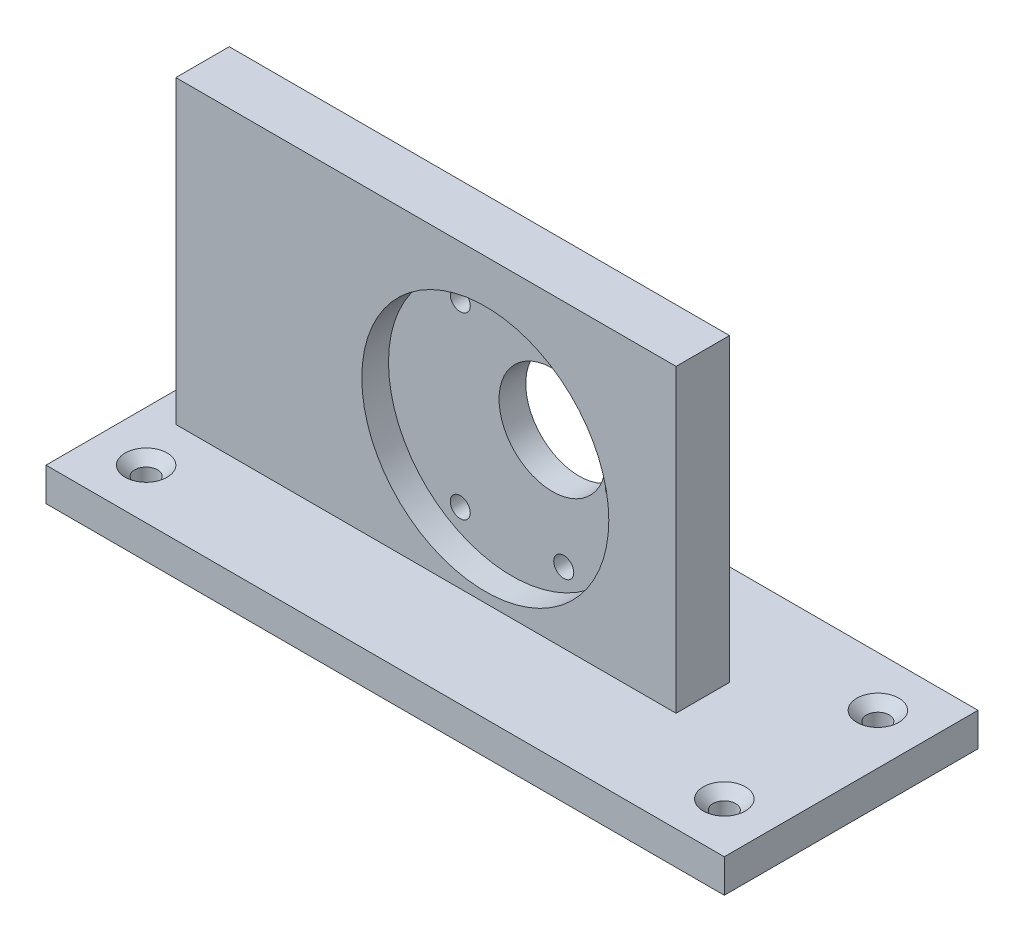
from build123d import *

# Parameters (mm, degrees)
SKETCH3_W                                       = 57.15
SKETCH3_H                                       = 50
BOSS_EXTRUDE1_DEPTH                             = 8
SKETCH3_3_R                                     = 1.5
SKETCH3_3_R_2                                   = 8
CUT_EXTRUDE2_DEPTH                              = 10
SKETCH4_R                                       = 18.5
CUT_EXTRUDE3_DEPTH                              = 4
BOSS_EXTRUDE2_DEPTH                             = 15
BOSS_EXTRUDE2_DEPTH_BACK                        = 23
SKETCH6_W                                       = 101.6
SKETCH6_H                                       = 5
CSK_FOR_M3_FLAT_HEAD_MACHINE_SCREW1_D           = 3.4
CSK_FOR_M3_FLAT_HEAD_MACHINE_SCREW1_CSINK_D     = 6.3
CSK_FOR_M3_FLAT_HEAD_MACHINE_SCREW1_CSINK_ANGLE = 90
CUT_EXTRUDE6_REACH                              = 555.432
SKETCH16_R                                      = 1.7
CUT_EXTRUDE7_REACH                              = 73.656
SKETCH17_W                                      = 25.08228791
SKETCH17_H                                      = 11.980848154
SKETCH18_W                                      = 17.78
SKETCH18_H                                      = 8
BOSS_EXTRUDE3_DEPTH                             = 45
SKETCH13_R                                      = 6.7056
SKETCH13_R_2                                    = 4.8006
BOSS_EXTRUDE4_DEPTH                             = 5.08
CUT_EXTRUDE8_START                              = -5.08
SKETCH19_R                                      = 4.8006
CUT_EXTRUDE8_DEPTH                              = 5.08


with BuildPart() as part:
    # Sketch3 → Boss-Extrude1 (new body)
    with BuildSketch(Plane.XY):
        with Locations((0, 25)):
            Rectangle(SKETCH3_W, SKETCH3_H)
    extrude(amount=BOSS_EXTRUDE1_DEPTH)

    # Sketch3<3> → Cut-Extrude2 (cut)
    with BuildSketch(Plane.XY):
        with Locations(Location((-7.75, 38.423393759, 0), (0, 0, 180))):
            Circle(SKETCH3_3_R)
        with Locations(Location((7.75, 38.423393759, 0), (0, 0, 180))):
            Circle(SKETCH3_3_R)
        with Locations(Location((-7.75, 11.576606241, 0), (0, 0, 180))):
            Circle(SKETCH3_3_R)
        with Locations(Location((7.75, 11.576606241, 0), (0, 0, 180))):
            Circle(SKETCH3_3_R)
        with Locations(Location((15.5, 25, 0), (0, 0, 180))):
            Circle(SKETCH3_3_R)
        with Locations(Location((6.062177825, 28.499999999, 0), (0, 0, 180))):
            Circle(SKETCH3_3_R_2)
    extrude(amount=CUT_EXTRUDE2_DEPTH, mode=Mode.SUBTRACT)

    # Sketch4 → Cut-Extrude3 (cut)
    with BuildSketch(Plane.XY.offset(8)):
        with Locations((0, 25)):
            Circle(SKETCH4_R)
    extrude(amount=-CUT_EXTRUDE3_DEPTH, mode=Mode.SUBTRACT)

    # Sketch6 → Boss-Extrude2 (add, two sides: drawn at the far end of the back side and taken through both)
    with BuildSketch(Plane.XY.offset(8).offset(-BOSS_EXTRUDE2_DEPTH_BACK)):
        with Locations((0, 2.5)):
            Rectangle(SKETCH6_W, SKETCH6_H)
    extrude(amount=BOSS_EXTRUDE2_DEPTH + BOSS_EXTRUDE2_DEPTH_BACK)

    # CSK for M3 Flat Head Machine Screw1 (through all)
    with Locations(Plane(origin=(0, 5, 0), x_dir=(1, 0, 0), z_dir=(0, 1, 0))):
        with Locations((-43.3, 7.5), (-43.3, -15.5), (43.3, -15.5), (43.3, 7.5)):
            CounterSinkHole(CSK_FOR_M3_FLAT_HEAD_MACHINE_SCREW1_D / 2, CSK_FOR_M3_FLAT_HEAD_MACHINE_SCREW1_CSINK_D / 2, counter_sink_angle=CSK_FOR_M3_FLAT_HEAD_MACHINE_SCREW1_CSINK_ANGLE)

    # Sketch16 → Cut-Extrude6 (cut, up to next)
    with BuildSketch(Plane(origin=(-499.248949842, 16.821159134, -28.308871479), x_dir=(0.050830850863696445, -0.0009181581696577921, 0.9987068546806156), z_dir=(0.036090886531912156, 0.9993480899541041, -0.0009181581696584951)), mode=Mode.PRIVATE) as cut_extrude6_sk1:
        with Locations((67.5, 464.499999998)):
            Circle(SKETCH16_R)
    cut_extrude6_tool1 = extrude(cut_extrude6_sk1.sketch, amount=-CUT_EXTRUDE6_REACH, mode=Mode.PRIVATE) & part.part
    # Sketch16 → Cut-Extrude6 (cut, up to next)
    with BuildSketch(Plane(origin=(-499.248949842, 16.821159134, -28.308871479), x_dir=(0.050830850863696445, -0.0009181581696577921, 0.9987068546806156), z_dir=(0.036090886531912156, 0.9993480899541041, -0.0009181581696584951)), mode=Mode.PRIVATE) as cut_extrude6_sk2:
        with Locations((44.5, 464.499999998)):
            Circle(SKETCH16_R)
    cut_extrude6_tool2 = extrude(cut_extrude6_sk2.sketch, amount=-CUT_EXTRUDE6_REACH, mode=Mode.PRIVATE) & part.part
    add(cut_extrude6_tool1.solids().sort_by_distance((-32.221346, -0.005033, 15.492911))[0], mode=Mode.SUBTRACT)
    add(cut_extrude6_tool2.solids().sort_by_distance((-33.390455, 0.016084, -7.477347))[0], mode=Mode.SUBTRACT)

    # Sketch17 → Cut-Extrude7 (cut, up to next)
    with BuildSketch(Plane(origin=(0, 5, 0), x_dir=(1, 0, 0), z_dir=(0, 1, 0)), mode=Mode.PRIVATE) as cut_extrude7_sk1:
        with Locations((-38.258856045, 9.009575923)):
            Rectangle(SKETCH17_W, SKETCH17_H)
    cut_extrude7_tool1 = extrude(cut_extrude7_sk1.sketch, amount=-CUT_EXTRUDE7_REACH, mode=Mode.PRIVATE) & part.part
    add(cut_extrude7_tool1.solids().sort_by_distance((-38.258856, 5, -9.009576))[0], mode=Mode.SUBTRACT)

    # Sketch18 → Boss-Extrude3 (add)
    with BuildSketch(Plane(origin=(0, 5, 0), x_dir=(1, 0, 0), z_dir=(0, 1, 0))):
        with Locations((-37.465, -4)):
            Rectangle(SKETCH18_W, SKETCH18_H)
    extrude(amount=BOSS_EXTRUDE3_DEPTH)

    # Sketch13 → Boss-Extrude4 (add)
    with BuildSketch(Plane(origin=(0, 0, 0), x_dir=(-1, 0, 0), z_dir=(0, 0, -1))):
        with Locations((38.117822207, 28.499999999)):
            Circle(SKETCH13_R)
        with Locations((38.117822207, 28.499999999)):
            Circle(SKETCH13_R_2, mode=Mode.SUBTRACT)
    extrude(amount=BOSS_EXTRUDE4_DEPTH)

    # Sketch19 → Cut-Extrude8 (cut)
    with BuildSketch(Plane(origin=(0, 0, 0), x_dir=(-1, 0, 0), z_dir=(0, 0, -1)).offset(CUT_EXTRUDE8_START)):
        with Locations((38.117822207, 28.499999999)):
            Circle(SKETCH19_R)
    extrude(amount=CUT_EXTRUDE8_DEPTH, mode=Mode.SUBTRACT)


solid = part.part
